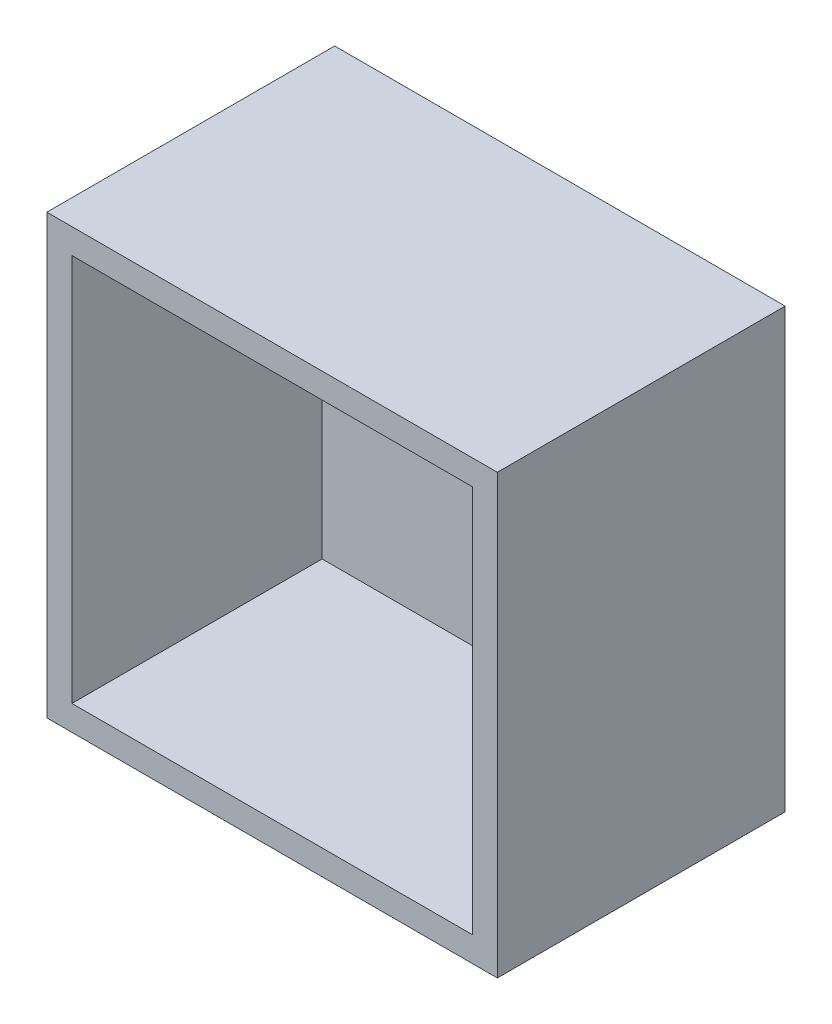
from build123d import *

# Parameters (mm, degrees)
ESQUISSE1_W             = 32
ESQUISSE1_H             = 31
BOSS_EXTRU_1_DEPTH      = 3
BOSS_EXTRU_2_DEPTH      = 20
BOSS_EXTRU_2_DEPTH_BACK = 3
ESQUISSE2_W             = 36
ESQUISSE2_H             = 35
ESQUISSE2_W_2           = 32
ESQUISSE2_H_2           = 31
ESQUISSE3_R             = 1.5
ENL_V_MAT_EXTRU_1_DEPTH = 52.429563482
ESQUISSE4_R             = 6
ENL_V_MAT_EXTRU_2_DEPTH = 1


with BuildPart() as part:
    # Esquisse1 → Boss.-Extru.1 (new body)
    with BuildSketch(Plane.XY):
        with Locations((-16, 15.5)):
            Rectangle(ESQUISSE1_W, ESQUISSE1_H)
    extrude(amount=BOSS_EXTRU_1_DEPTH)

    # Esquisse2 → Boss.-Extru.2 (add, two sides: drawn at the far end of the back side and taken through both)
    with BuildSketch(Plane.XY.offset(3).offset(-BOSS_EXTRU_2_DEPTH_BACK)):
        with Locations((-16, 15.5)):
            Rectangle(ESQUISSE2_W, ESQUISSE2_H)
        with Locations((-16, 15.5)):
            Rectangle(ESQUISSE2_W_2, ESQUISSE2_H_2, mode=Mode.SUBTRACT)
    extrude(amount=BOSS_EXTRU_2_DEPTH + BOSS_EXTRU_2_DEPTH_BACK)

    # Esquisse3 → Enlèv. mat.-Extru.1 (cut, through all)
    with BuildSketch(Plane.XY.offset(3)):
        with Locations((-24.982527988, 24.201823988)):
            Circle(ESQUISSE3_R)
        with Locations((-7.026522418, 6.806943593)):
            Circle(ESQUISSE3_R)
    extrude(amount=-ENL_V_MAT_EXTRU_1_DEPTH, mode=Mode.SUBTRACT)

    # Esquisse4 → Enlèv. mat.-Extru.2 (cut)
    with BuildSketch(Plane.XY.offset(3)):
        with Locations((-24.982527988, 24.201823988)):
            Circle(ESQUISSE4_R)
        with Locations((-7.026522418, 6.806943593)):
            Circle(ESQUISSE4_R)
    extrude(amount=-ENL_V_MAT_EXTRU_2_DEPTH, mode=Mode.SUBTRACT)


solid = part.part
